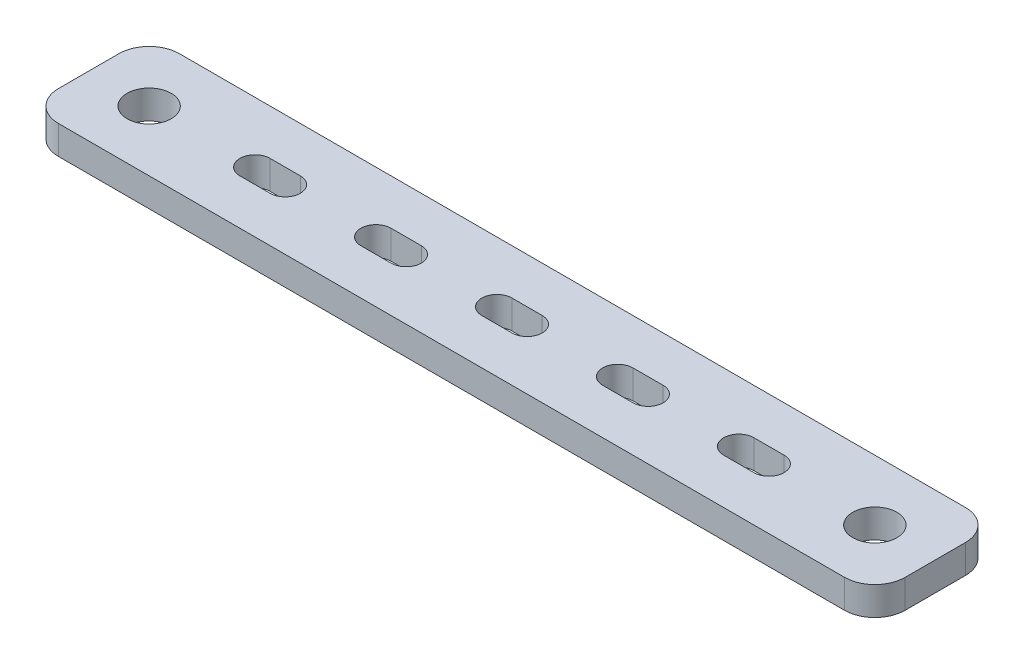
from build123d import *

# Parameters (mm, degrees)
SKETCH1_W           = 177.8
SKETCH1_H           = 25.4
BOSS_EXTRUDE1_DEPTH = 6
CUT_EXTRUDE2_DEPTH  = 91.002777735
FILLET1_R           = 6.35
SKETCH5_R           = 4.6355
CUT_EXTRUDE3_DEPTH  = 91.002777735


with BuildPart() as part:
    # Sketch1 → Boss-Extrude1 (new body)
    with BuildSketch(Plane(origin=(0, 0, 0), x_dir=(1, 0, 0), z_dir=(0, 1, 0))):
        Rectangle(SKETCH1_W, SKETCH1_H)
    extrude(amount=BOSS_EXTRUDE1_DEPTH)

    # Sketch4 → Cut-Extrude2 (cut, through all)
    with BuildSketch(Plane.XZ):
        with BuildLine():
            Line((-53.975, 3.175), (-47.625, 3.175))
            ThreePointArc((-47.625, 3.175), (-44.45, 0), (-47.625, -3.175))
            Line((-47.625, -3.175), (-53.975, -3.175))
            ThreePointArc((-53.975, -3.175), (-57.15, 0), (-53.975, 3.175))
        make_face()
        with BuildLine():
            Line((-28.575, 3.175), (-22.225, 3.175))
            ThreePointArc((-22.225, 3.175), (-19.05, 0), (-22.225, -3.175))
            Line((-22.225, -3.175), (-28.575, -3.175))
            ThreePointArc((-28.575, -3.175), (-31.75, 0), (-28.575, 3.175))
        make_face()
        with BuildLine():
            Line((-3.175, 3.175), (3.175, 3.175))
            ThreePointArc((3.175, 3.175), (6.35, 0), (3.175, -3.175))
            Line((3.175, -3.175), (-3.175, -3.175))
            ThreePointArc((-3.175, -3.175), (-6.35, 0), (-3.175, 3.175))
        make_face()
        with BuildLine():
            Line((22.225, 3.175), (28.575, 3.175))
            ThreePointArc((28.575, 3.175), (31.75, 0), (28.575, -3.175))
            Line((28.575, -3.175), (22.225, -3.175))
            ThreePointArc((22.225, -3.175), (19.05, 0), (22.225, 3.175))
        make_face()
        with BuildLine():
            Line((47.625, 3.175), (53.975, 3.175))
            ThreePointArc((53.975, 3.175), (57.15, 0), (53.975, -3.175))
            Line((53.975, -3.175), (47.625, -3.175))
            ThreePointArc((47.625, -3.175), (44.45, 0), (47.625, 3.175))
        make_face()
    extrude(amount=-CUT_EXTRUDE2_DEPTH, mode=Mode.SUBTRACT)

    # Fillet1
    fillet1_edges = [part.edges().sort_by_distance(p)[0] for p in [
        (-88.9, 3, -12.7),
        (88.9, 3, -12.7),
        (88.9, 3, 12.7),
        (-88.9, 3, 12.7),
    ]]
    fillet(fillet1_edges, radius=FILLET1_R)

    # Sketch5 → Cut-Extrude3 (cut, through all)
    with BuildSketch(Plane(origin=(0, 6, 0), x_dir=(1, 0, 0), z_dir=(0, 1, 0))):
        with Locations(Location((-76.2, 0, 0), (0, 0, 270))):
            Circle(SKETCH5_R)
    cut_extrude3 = extrude(amount=-CUT_EXTRUDE3_DEPTH, mode=Mode.SUBTRACT)

    # Mirror1: Cut-Extrude3 across plane
    add(cut_extrude3.mirror(Plane(origin=(0, 0, 0), x_dir=(0, 0, 1), z_dir=(1, 0, 0))), mode=Mode.SUBTRACT)


solid = part.part
